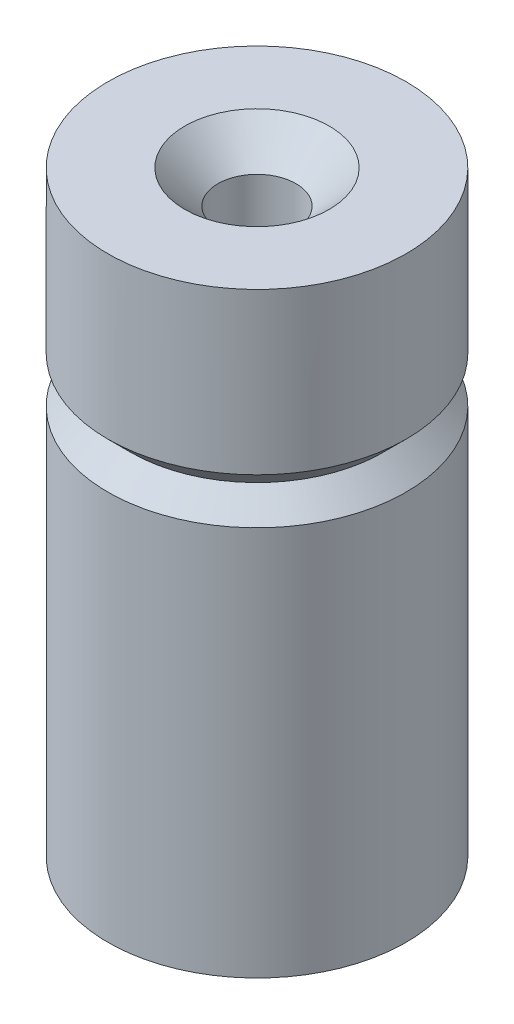
from build123d import *

# Parameters (mm, degrees)
SKETCH_1_R                  = 6.5
EXTRUDE_1_DEPTH             = 26
SKETCH_2_R                  = 2.85
CUT_EXTRUDE_1_DEPTH         = 3.5
HOLE_WIZARD_M32_D           = 3.4
HOLE_WIZARD_M32_CSINK_D     = 6.3
HOLE_WIZARD_M32_CSINK_ANGLE = 90


with BuildPart() as part:
    # Эскиз1 → Бобышка-Вытянуть1 (new body)
    with BuildSketch(Plane(origin=(0, 0, 0), x_dir=(1, 0, 0), z_dir=(0, 1, 0))):
        with Locations(Location((0, 0, 0), (0, 0, 90))):
            Circle(SKETCH_1_R)
    extrude(amount=EXTRUDE_1_DEPTH)

    # Эскиз2 → Вырез-Вытянуть1 (cut)
    with BuildSketch(Plane.XZ):
        with Locations(Location((0, 0, 0), (0, 0, 270))):
            Circle(SKETCH_2_R)
    extrude(amount=-CUT_EXTRUDE_1_DEPTH, mode=Mode.SUBTRACT)

    # Зенковка для  винта с плоской головкой M32 (through all)
    with Locations(Plane(origin=(0, 26, 0), x_dir=(1, 0, 0), z_dir=(0, 1, 0))):
        with Locations((0, 0)):
            CounterSinkHole(HOLE_WIZARD_M32_D / 2, HOLE_WIZARD_M32_CSINK_D / 2, counter_sink_angle=HOLE_WIZARD_M32_CSINK_ANGLE)

    # Вырез-По траектории2: sweep along a path in Эскиз5
    with BuildLine(Plane(origin=(0, 18, 0), x_dir=(-1, 0, 0), z_dir=(0, -1, 0))) as sweep_2_path:
        CenterArc((0, 0), 6.5, 0, 360)
    # Эскиз6 → Вырез-По траектории2 (sweep, cut)
    with BuildSketch(Plane(origin=(0, 0, 0), x_dir=(0, 0, -1), z_dir=(1, 0, 0))):
        Polygon((6.5, 19), (5.5, 18), (6.5, 17), align=None)
    sweep(path=sweep_2_path.line, mode=Mode.SUBTRACT)


solid = part.part
